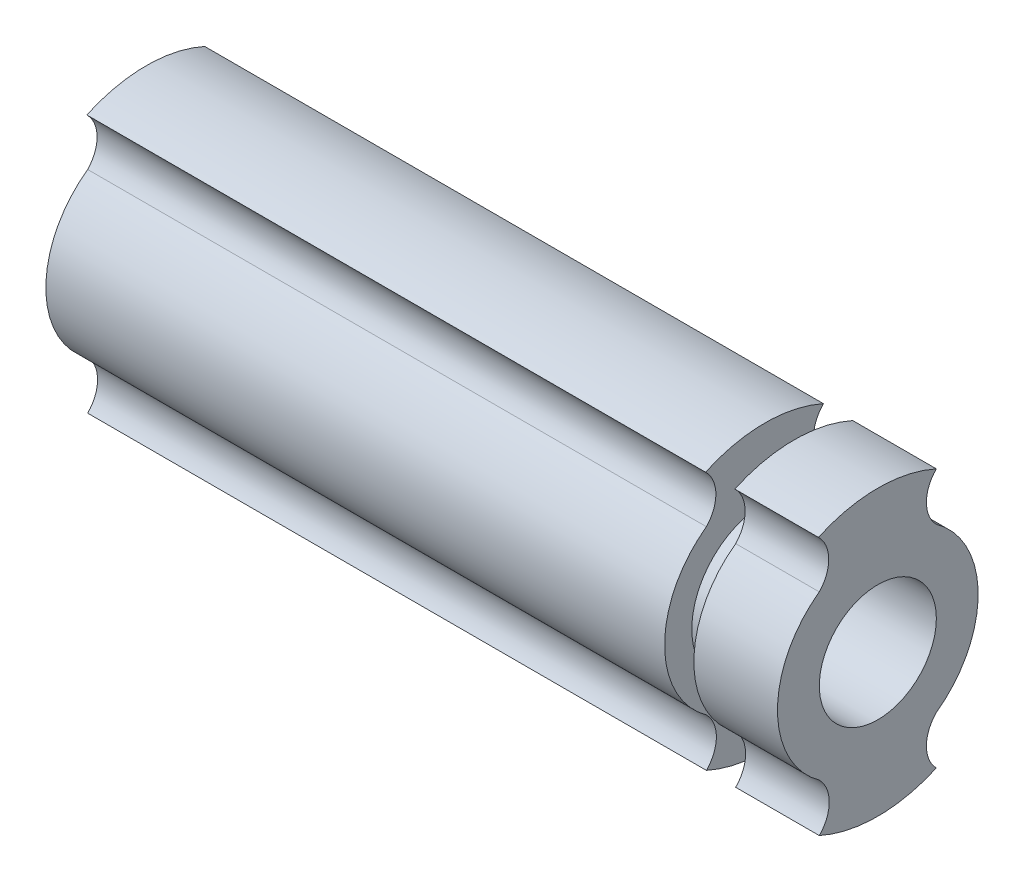
from build123d import *

# Parameters (mm, degrees)
SKETCH1_R           = 14
BOSS_EXTRUDE1_DEPTH = 175
SKETCH5_W           = 7
SKETCH5_H           = 23.880326309


with BuildPart() as part:
    # Sketch1 → Boss-Extrude1 (new body)
    with BuildSketch(Plane(origin=(0, 0, 0), x_dir=(0, 0, -1), z_dir=(1, 0, 0))):
        with BuildLine():
            ThreePointArc((-14, 19.49358869), (-24, 0), (-14, -19.49358869))
            ThreePointArc((-14, -19.49358869), (-11.620285492, -25.23872773), (-14, -30.98386677))
            ThreePointArc((-14, -30.98386677), (0, -34), (14, -30.98386677))
            ThreePointArc((14, -30.98386677), (11.620285492, -25.23872773), (14, -19.49358869))
            ThreePointArc((14, -19.49358869), (24, 0), (14, 19.49358869))
            ThreePointArc((14, 19.49358869), (11.620285492, 25.23872773), (14, 30.98386677))
            ThreePointArc((14, 30.98386677), (-0.111150927, 33.999818315), (-14.202281174, 30.891668933))
            ThreePointArc((-14.202281174, 30.891668933), (-11.740520876, 25.234522614), (-14, 19.49358869))
        make_face()
        Circle(SKETCH1_R, mode=Mode.SUBTRACT)
    extrude(amount=BOSS_EXTRUDE1_DEPTH)

    # Sketch5 → Cut-Revolve1 (revolve, cut)
    with BuildSketch(Plane.XY, mode=Mode.PRIVATE) as cut_revolve1_sk:
        with Locations((151.5, 29.440163155)):
            Rectangle(SKETCH5_W, SKETCH5_H)
    revolve(cut_revolve1_sk.sketch.rotate(Axis((175, 0, 0), (-1, 0, 0)), 90), axis=Axis((175, 0, 0), (-1, 0, 0)), mode=Mode.SUBTRACT)


solid = part.part
